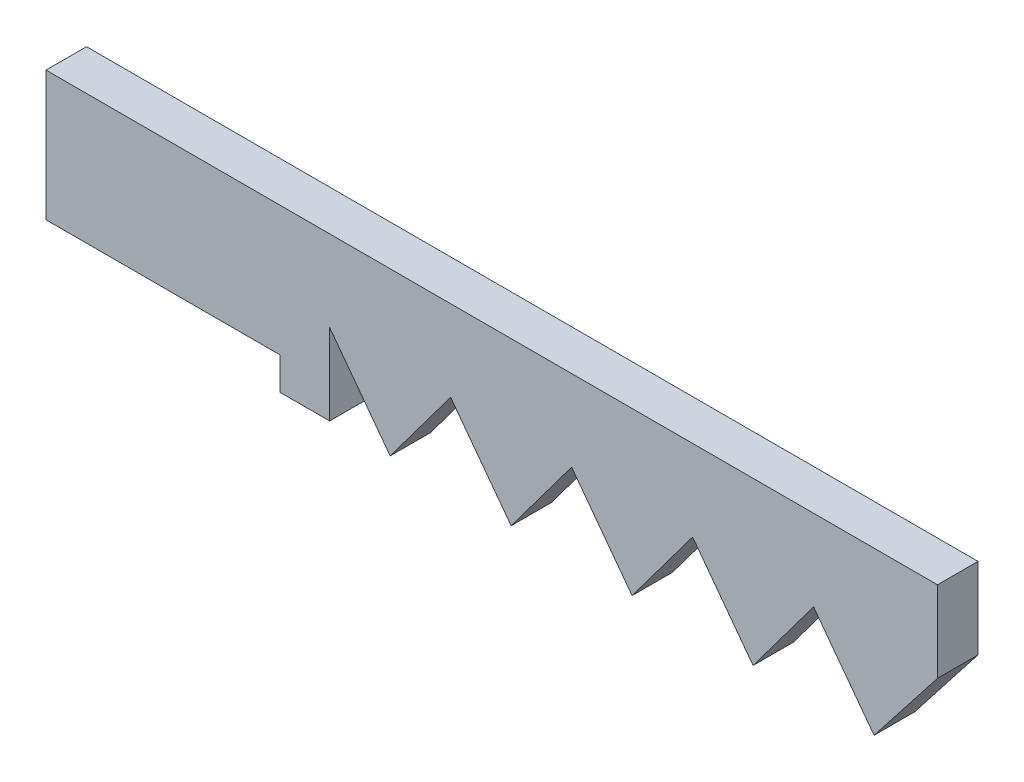
from build123d import *

# Parameters (mm, degrees)
BOSS_EXTRUDE1_DEPTH = 2.54
CUT_EXTRUDE2_DEPTH  = 2.032


with BuildPart() as part:
    # Sketch1 → Boss-Extrude1 (new body)
    with BuildSketch(Plane.XY):
        Polygon((-27.94, 0), (-10.16, 0), (-10.16, 5.08), (-6.368400563, 0), (-2.576801125, 5.08), (1.214798312, 0), (5.006397749, 5.08), (8.797997187, 0), (12.589596624, 5.08), (16.381196061, 0), (20.172795499, 5.08), (23.964394936, 0), (27.94, 5.08), (27.94, 10.16), (-27.94, 10.16), align=None)
    extrude(amount=BOSS_EXTRUDE1_DEPTH)

    # Sketch2 → Cut-Extrude2 (cut)
    with BuildSketch(Plane.XZ):
        with BuildLine():
            Line((-27.94, 0), (-13.275788511, 0))
            ThreePointArc((-13.275788511, 0), (-12.7, 1.27), (-13.275788511, 2.54))
            Line((-13.275788511, 2.54), (-27.94, 2.54))
            Line((-27.94, 2.54), (-27.94, 0))
        make_face()
    extrude(amount=-CUT_EXTRUDE2_DEPTH, mode=Mode.SUBTRACT)


solid = part.part
